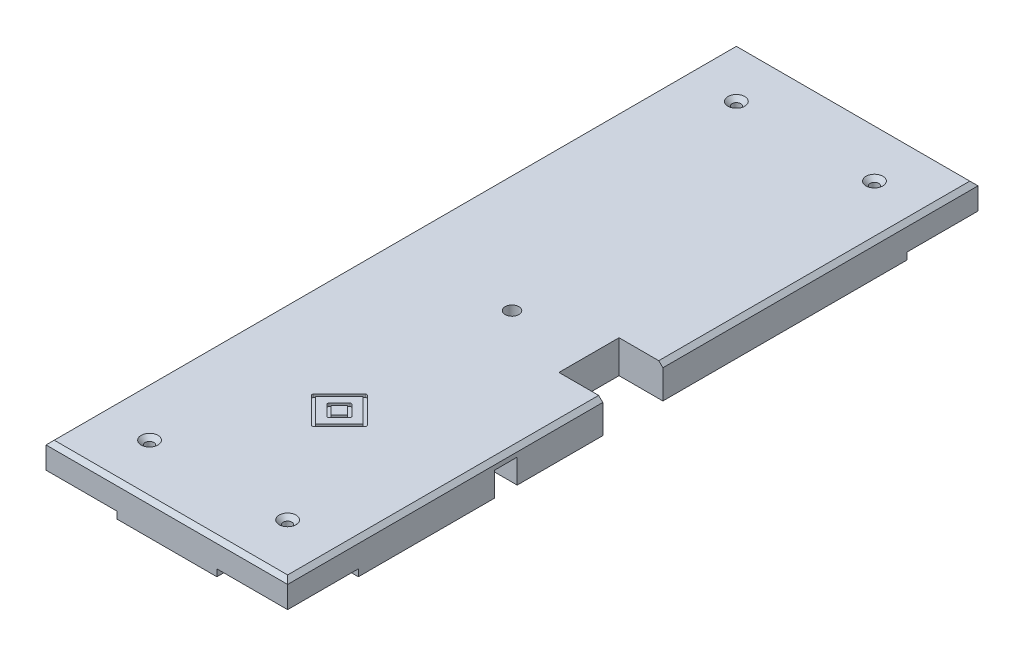
from build123d import *

# Parameters (mm, degrees)
BOSS_EXTRUDE1_DEPTH = 4
SKETCH2_W           = 140
SKETCH2_H           = 400
BOSS_EXTRUDE2_DEPTH = 15.05
SKETCH3_W           = 8
SKETCH3_H           = 22
SKETCH3_H_2         = 8
SKETCH3_W_2         = 22
SKETCH3_R           = 2.5
CUT_EXTRUDE1_DEPTH  = 5
CUT_EXTRUDE2_REACH  = 255.21
SKETCH4_R           = 2.5
CHAMFER1_SIZE       = 2.38
CUT_EXTRUDE3_REACH  = 255.48
SKETCH5_R           = 4
CUT_EXTRUDE4_DEPTH  = 1.75
SKETCH7_W           = 50
SKETCH7_H           = 13
CUT_EXTRUDE5_DEPTH  = 14.05
CUT_EXTRUDE6_REACH  = 255.48
SKETCH8_W           = 25.391909776
SKETCH8_H           = 34.82217309


with BuildPart() as part:
    # Sketch1 → Boss-Extrude1 (new body)
    with BuildSketch(Plane(origin=(0, -20.720705818, 0), x_dir=(1, 0, 0), z_dir=(0, 1, 0))):
        Polygon((6.005034784, -235.03386434), (6.005034784, -194.03386434), (47.005034784, -194.03386434), (47.005034784, 123.96613566), (6.005034784, 123.96613566), (6.005034784, 164.96613566), (-51.994965216, 164.96613566), (-51.994965216, 123.96613566), (-92.994965216, 123.96613566), (-92.994965216, -194.03386434), (-51.994965216, -194.03386434), (-51.994965216, -235.03386434), align=None)
    extrude(amount=-BOSS_EXTRUDE1_DEPTH)

    # Sketch2 → Boss-Extrude2 (add)
    with BuildSketch(Plane(origin=(0, -20.720705818, 0), x_dir=(1, 0, 0), z_dir=(0, 1, 0))):
        with Locations((-22.994965216, -35.03386434)):
            Rectangle(SKETCH2_W, SKETCH2_H)
    extrude(amount=BOSS_EXTRUDE2_DEPTH)

    # Sketch3 → Cut-Extrude1 (cut)
    # profile 1 of 14: a face of its own
    with BuildSketch(Plane.XZ.offset(20.720705818)):
        with Locations((37.005034784, 210.03386434)):
            Rectangle(SKETCH3_W, SKETCH3_H)
    # profile 2 of 14: a face of its own
    with BuildSketch(Plane.XZ.offset(20.720705818)):
        with Locations((37.005034784, 225.03386434)):
            Rectangle(SKETCH3_W, SKETCH3_H_2)
    # profile 3 of 14: a face of its own
    with BuildSketch(Plane.XZ.offset(20.720705818)):
        with Locations((22.005034784, 225.03386434)):
            Rectangle(SKETCH3_W_2, SKETCH3_H_2)
    # profile 4 of 14: a face of its own
    with BuildSketch(Plane.XZ.offset(20.720705818)):
        with Locations((-67.994965216, 225.03386434)):
            Rectangle(SKETCH3_W_2, SKETCH3_H_2)
    # profile 5 of 14: a face of its own
    with BuildSketch(Plane.XZ.offset(20.720705818)):
        with Locations((-82.994965216, 210.03386434)):
            Rectangle(SKETCH3_W, SKETCH3_H)
    # profile 6 of 14: a face of its own
    with BuildSketch(Plane.XZ.offset(20.720705818)):
        with Locations((-82.994965216, 225.03386434)):
            Rectangle(SKETCH3_W, SKETCH3_H_2)
        with Locations((-82.994965216, 225.03386434)):
            Circle(SKETCH3_R, mode=Mode.SUBTRACT)
    # profile 7 of 14: a face of its own
    with BuildSketch(Plane.XZ.offset(20.720705818)):
        with Locations((-82.994965216, 225.03386434)):
            Circle(SKETCH3_R)
    # profile 8 of 14: a face of its own
    with BuildSketch(Plane.XZ.offset(20.720705818)):
        with Locations((-67.994965216, -154.96613566)):
            Rectangle(SKETCH3_W_2, SKETCH3_H_2)
    # profile 9 of 14: a face of its own
    with BuildSketch(Plane.XZ.offset(20.720705818)):
        with Locations((-82.994965216, -139.96613566)):
            Rectangle(SKETCH3_W, SKETCH3_H)
    # profile 10 of 14: a face of its own
    with BuildSketch(Plane.XZ.offset(20.720705818)):
        with Locations((-82.994965216, -154.96613566)):
            Rectangle(SKETCH3_W, SKETCH3_H_2)
        with Locations((-82.994965216, -154.96613566)):
            Circle(SKETCH3_R, mode=Mode.SUBTRACT)
    # profile 11 of 14: a face of its own
    with BuildSketch(Plane.XZ.offset(20.720705818)):
        with Locations((-82.994965216, -154.96613566)):
            Circle(SKETCH3_R)
    # profile 12 of 14: a face of its own
    with BuildSketch(Plane.XZ.offset(20.720705818)):
        with Locations((37.005034784, -154.96613566)):
            Rectangle(SKETCH3_W, SKETCH3_H_2)
    # profile 13 of 14: a face of its own
    with BuildSketch(Plane.XZ.offset(20.720705818)):
        with Locations((22.005034784, -154.96613566)):
            Rectangle(SKETCH3_W_2, SKETCH3_H_2)
    # profile 14 of 14: a face of its own
    with BuildSketch(Plane.XZ.offset(20.720705818)):
        with Locations((37.005034784, -139.96613566)):
            Rectangle(SKETCH3_W, SKETCH3_H)
    extrude(amount=-CUT_EXTRUDE1_DEPTH, mode=Mode.SUBTRACT)

    # Sketch4 → Cut-Extrude2 (cut, up to next)
    with BuildSketch(Plane.XZ.offset(20.720705818), mode=Mode.PRIVATE) as cut_extrude2_sk1:
        with Locations(Location((-62.994965216, -134.96613566, 0), (0, 0, 270))):
            Circle(SKETCH4_R)
    cut_extrude2_tool1 = extrude(cut_extrude2_sk1.sketch, amount=-CUT_EXTRUDE2_REACH, mode=Mode.PRIVATE) & part.part
    # Sketch4 → Cut-Extrude2 (cut, up to next)
    with BuildSketch(Plane.XZ.offset(20.720705818), mode=Mode.PRIVATE) as cut_extrude2_sk2:
        with Locations(Location((17.005034784, -134.96613566, 0), (0, 0, 90))):
            Circle(SKETCH4_R)
    cut_extrude2_tool2 = extrude(cut_extrude2_sk2.sketch, amount=-CUT_EXTRUDE2_REACH, mode=Mode.PRIVATE) & part.part
    # Sketch4 → Cut-Extrude2 (cut, up to next)
    with BuildSketch(Plane.XZ.offset(20.720705818), mode=Mode.PRIVATE) as cut_extrude2_sk3:
        with Locations(Location((-62.994965216, 205.03386434, 0), (0, 0, 270))):
            Circle(SKETCH4_R)
    cut_extrude2_tool3 = extrude(cut_extrude2_sk3.sketch, amount=-CUT_EXTRUDE2_REACH, mode=Mode.PRIVATE) & part.part
    # Sketch4 → Cut-Extrude2 (cut, up to next)
    with BuildSketch(Plane.XZ.offset(20.720705818), mode=Mode.PRIVATE) as cut_extrude2_sk4:
        with Locations(Location((17.005034784, 205.03386434, 0), (0, 0, 270))):
            Circle(SKETCH4_R)
    cut_extrude2_tool4 = extrude(cut_extrude2_sk4.sketch, amount=-CUT_EXTRUDE2_REACH, mode=Mode.PRIVATE) & part.part
    add(cut_extrude2_tool1.solids().sort_by_distance((-62.994965, -20.720706, -134.966136))[0], mode=Mode.SUBTRACT)
    add(cut_extrude2_tool2.solids().sort_by_distance((17.005035, -20.720706, -134.966136))[0], mode=Mode.SUBTRACT)
    add(cut_extrude2_tool3.solids().sort_by_distance((-62.994965, -20.720706, 205.033864))[0], mode=Mode.SUBTRACT)
    add(cut_extrude2_tool4.solids().sort_by_distance((17.005035, -20.720706, 205.033864))[0], mode=Mode.SUBTRACT)

    # Chamfer1
    chamfer1_edges = [part.edges().sort_by_distance(p)[0] for p in [
        (17.005034784, -5.670705818, -137.46613566),
        (-62.994965216, -5.670705818, 207.53386434),
        (17.005034784, -5.670705818, 207.53386434),
        (-62.994965216, -5.670705818, -132.46613566),
        (-92.994965216, -5.670705818, 35.03386434),
        (-22.994965216, -5.670705818, 235.03386434),
        (47.005034784, -5.670705818, 35.03386434),
        (-22.994965216, -5.670705818, -164.96613566),
    ]]
    chamfer(chamfer1_edges, length=CHAMFER1_SIZE)

    # Sketch5 → Cut-Extrude3 (cut, up to next)
    with BuildSketch(Plane(origin=(0, -5.670705818, 0), x_dir=(1, 0, 0), z_dir=(0, 1, 0)), mode=Mode.PRIVATE) as cut_extrude3_sk1:
        with Locations(Location((-22.994965216, -35.03386434, 0), (0, 0, 270))):
            Circle(SKETCH5_R)
    cut_extrude3_tool1 = extrude(cut_extrude3_sk1.sketch, amount=-CUT_EXTRUDE3_REACH, mode=Mode.PRIVATE) & part.part
    add(cut_extrude3_tool1.solids().sort_by_distance((-22.994965, -5.670706, 35.033864))[0], mode=Mode.SUBTRACT)

    # Sketch6 → Cut-Extrude4 (cut)
    # profile 1 of 2: a face of its own
    with BuildSketch(Plane(origin=(0, -5.670705818, 0), x_dir=(1, 0, 0), z_dir=(0, 1, 0))):
        with BuildLine():
            Line((-38.613683649, -135.652582773), (-23.613683649, -150.652582773))
            ThreePointArc((-23.613683649, -150.652582773), (-22.994965216, -150.90886434), (-22.376246782, -150.652582773))
            Line((-22.376246782, -150.652582773), (-7.376246782, -135.652582773))
            ThreePointArc((-7.376246782, -135.652582773), (-7.119965216, -135.03386434), (-7.376246782, -134.415145906))
            Line((-7.376246782, -134.415145906), (-22.376246782, -119.415145906))
            ThreePointArc((-22.376246782, -119.415145906), (-22.994965216, -119.15886434), (-23.613683649, -119.415145906))
            Line((-23.613683649, -119.415145906), (-38.613683649, -134.415145906))
            ThreePointArc((-38.613683649, -134.415145906), (-38.869965216, -135.03386434), (-38.613683649, -135.652582773))
        make_face()
        Polygon((-9.232402083, -135.03386434), (-22.994965216, -148.796427473), (-36.757528349, -135.03386434), (-22.994965216, -121.271301207), align=None, mode=Mode.SUBTRACT)
    # profile 2 of 2: a face of its own
    with BuildSketch(Plane(origin=(0, -5.670705818, 0), x_dir=(1, 0, 0), z_dir=(0, 1, 0))):
        with BuildLine():
            Line((-22.376246782, -141.672326652), (-16.356502903, -135.652582773))
            ThreePointArc((-16.356502903, -135.652582773), (-16.100221337, -135.03386434), (-16.356502903, -134.415145906))
            Line((-16.356502903, -134.415145906), (-22.376246782, -128.395402027))
            ThreePointArc((-22.376246782, -128.395402027), (-22.994965216, -128.139120461), (-23.613683649, -128.395402027))
            Line((-23.613683649, -128.395402027), (-29.633427528, -134.415145906))
            ThreePointArc((-29.633427528, -134.415145906), (-29.889709095, -135.03386434), (-29.633427528, -135.652582773))
            Line((-29.633427528, -135.652582773), (-23.613683649, -141.672326652))
            ThreePointArc((-23.613683649, -141.672326652), (-22.994965216, -141.928608219), (-22.376246782, -141.672326652))
        make_face()
        Polygon((-22.994965216, -130.251557328), (-18.212658204, -135.03386434), (-22.994965216, -139.816171352), (-27.777272227, -135.03386434), align=None, mode=Mode.SUBTRACT)
    extrude(amount=-CUT_EXTRUDE4_DEPTH, mode=Mode.SUBTRACT)

    # Sketch7 → Cut-Extrude5 (cut)
    with BuildSketch(Plane.XZ.offset(24.720705818)):
        Polygon((-0.994965216, 115.03386434), (-0.994965216, 168.03386434), (-44.994965216, 168.03386434), (-44.994965216, 102.03386434), (-0.994965216, 102.03386434), align=None)
        with Locations((24.005034784, 108.53386434)):
            Rectangle(SKETCH7_W, SKETCH7_H)
    extrude(amount=-CUT_EXTRUDE5_DEPTH, mode=Mode.SUBTRACT)

    # Sketch8 → Cut-Extrude6 (cut, up to next)
    with BuildSketch(Plane(origin=(0, -5.670705818, 0), x_dir=(1, 0, 0), z_dir=(0, 1, 0)), mode=Mode.PRIVATE) as cut_extrude6_sk1:
        with Locations((34.309079896, -35.03386434)):
            Rectangle(SKETCH8_W, SKETCH8_H)
    cut_extrude6_tool1 = extrude(cut_extrude6_sk1.sketch, amount=-CUT_EXTRUDE6_REACH, mode=Mode.PRIVATE) & part.part
    add(cut_extrude6_tool1.solids().sort_by_distance((34.30908, -5.670706, 35.033864))[0], mode=Mode.SUBTRACT)


solid = part.part
